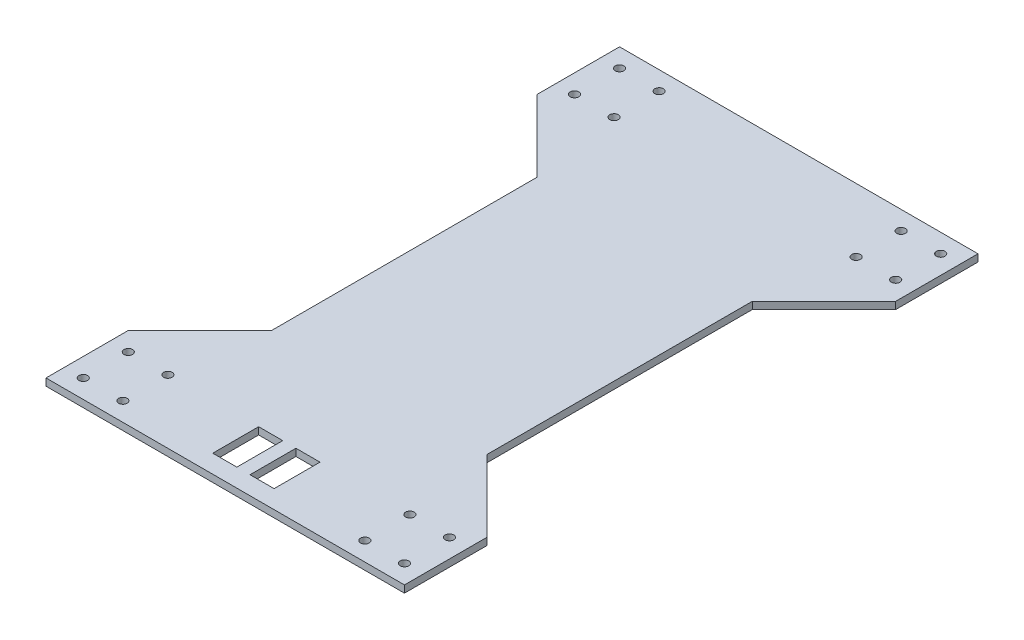
from build123d import *

# Parameters (mm, degrees)
SKETCH1_R           = 1.5
SKETCH1_W           = 8.4
SKETCH1_H           = 16
BOSS_EXTRUDE1_DEPTH = 2.5


with BuildPart() as part:
    # Sketch1 → Boss-Extrude1 (new body)
    with BuildSketch(Plane(origin=(0, 0, 0), x_dir=(1, 0, 0), z_dir=(0, 1, 0))):
        Polygon((0, 0), (125, 0), (125, 28.7), (100, 53.7), (100, 146.3), (125, 171.3), (125, 200), (0, 200), (0, 171.3), (25, 146.3), (25, 53.7), (0, 28.7), align=None)
        with Locations(Location((6.5, 6.5, 0), (0, 0, 270))):
            Circle(SKETCH1_R, mode=Mode.SUBTRACT)
        with Locations(Location((6.5, 22.2, 0), (0, 0, 270))):
            Circle(SKETCH1_R, mode=Mode.SUBTRACT)
        with Locations(Location((20.3, 6.5, 0), (0, 0, 270))):
            Circle(SKETCH1_R, mode=Mode.SUBTRACT)
        with Locations(Location((20.3, 22.2, 0), (0, 0, 270))):
            Circle(SKETCH1_R, mode=Mode.SUBTRACT)
        with Locations(Location((104.7, 6.5, 0), (0, 0, 90))):
            Circle(SKETCH1_R, mode=Mode.SUBTRACT)
        with Locations(Location((118.5, 6.5, 0), (0, 0, 90))):
            Circle(SKETCH1_R, mode=Mode.SUBTRACT)
        with Locations(Location((104.7, 22.2, 0), (0, 0, 90))):
            Circle(SKETCH1_R, mode=Mode.SUBTRACT)
        with Locations(Location((118.5, 22.2, 0), (0, 0, 90))):
            Circle(SKETCH1_R, mode=Mode.SUBTRACT)
        with Locations(Location((118.5, 177.8, 0), (0, 0, 270))):
            Circle(SKETCH1_R, mode=Mode.SUBTRACT)
        with Locations(Location((118.5, 193.5, 0), (0, 0, 270))):
            Circle(SKETCH1_R, mode=Mode.SUBTRACT)
        with Locations(Location((104.7, 193.5, 0), (0, 0, 270))):
            Circle(SKETCH1_R, mode=Mode.SUBTRACT)
        with Locations(Location((104.7, 177.8, 0), (0, 0, 270))):
            Circle(SKETCH1_R, mode=Mode.SUBTRACT)
        with Locations(Location((20.3, 193.5, 0), (0, 0, 90))):
            Circle(SKETCH1_R, mode=Mode.SUBTRACT)
        with Locations(Location((20.3, 177.8, 0), (0, 0, 90))):
            Circle(SKETCH1_R, mode=Mode.SUBTRACT)
        with Locations(Location((6.5, 193.5, 0), (0, 0, 90))):
            Circle(SKETCH1_R, mode=Mode.SUBTRACT)
        with Locations(Location((6.5, 177.8, 0), (0, 0, 90))):
            Circle(SKETCH1_R, mode=Mode.SUBTRACT)
        with Locations((56, 14.35)):
            Rectangle(SKETCH1_W, SKETCH1_H, mode=Mode.SUBTRACT)
        with Locations((69, 14.35)):
            Rectangle(SKETCH1_W, SKETCH1_H, mode=Mode.SUBTRACT)
    extrude(amount=BOSS_EXTRUDE1_DEPTH)


solid = part.part
